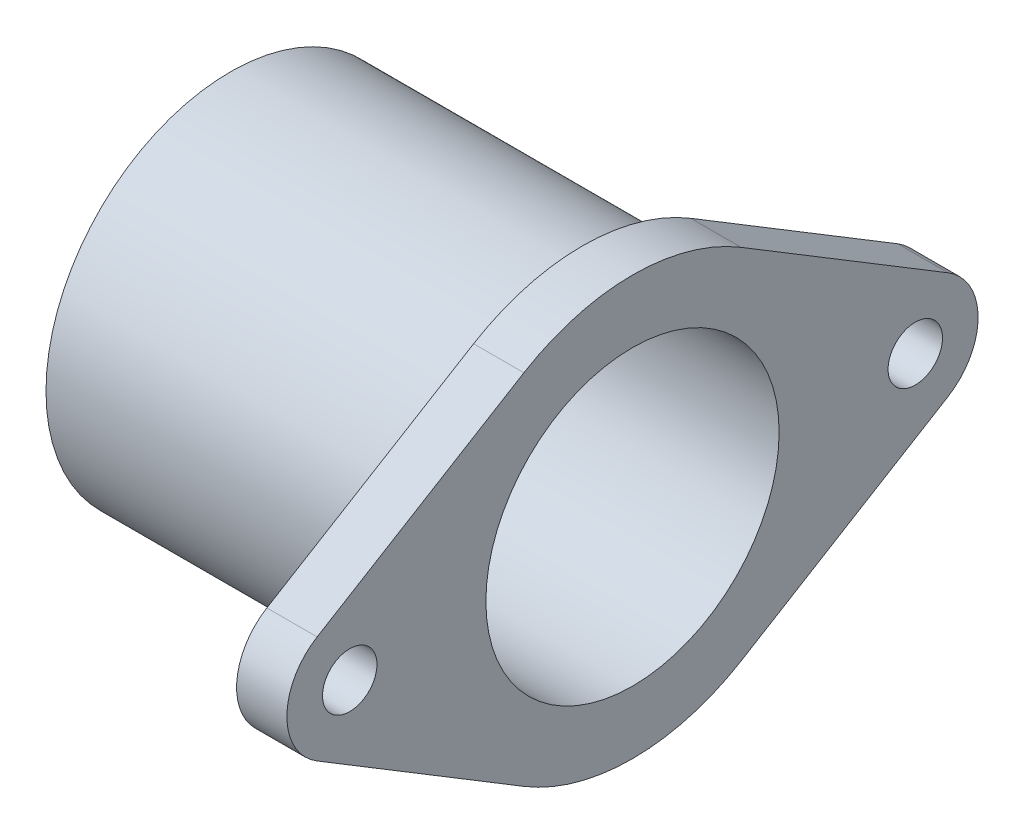
from build123d import *

# Parameters (mm, degrees)
SKETCH1_R           = 44
BOSS_EXTRUDE1_DEPTH = 84
BOSS_EXTRUDE2_DEPTH = 12
SKETCH5_R           = 6.5
CUT_EXTRUDE3_DEPTH  = 80
SKETCH6_R           = 35
CUT_EXTRUDE4_DEPTH  = 85
SKETCH7_R           = 25.25
CUT_EXTRUDE5_DEPTH  = 85


with BuildPart() as part:
    # Sketch1 → Boss-Extrude1 (new body)
    with BuildSketch(Plane(origin=(0, 0, 0), x_dir=(0, 0, -1), z_dir=(1, 0, 0))):
        with Locations(Location((0, 0, 0), (0, 0, 180))):
            Circle(SKETCH1_R)
    extrude(amount=BOSS_EXTRUDE1_DEPTH)

    # Sketch2 → Boss-Extrude2 (add)
    with BuildSketch(Plane(origin=(84, 0, 0), x_dir=(0, 0, -1), z_dir=(1, 0, 0))):
        with BuildLine():
            Line((-25.925925926, 42.753319928), (-75.277777778, 12.825995978))
            ThreePointArc((-75.277777778, 12.825995978), (-82.5, 0), (-75.277777778, -12.825995978))
            Line((-75.277777778, -12.825995978), (-25.925925926, -42.753319928))
            ThreePointArc((-25.925925926, -42.753319928), (0, -50), (25.925925926, -42.753319928))
            Line((25.925925926, -42.753319928), (75.277777778, -12.825995978))
            ThreePointArc((75.277777778, -12.825995978), (82.5, 0), (75.277777778, 12.825995978))
            Line((75.277777778, 12.825995978), (25.925925926, 42.753319928))
            ThreePointArc((25.925925926, 42.753319928), (0, 50), (-25.925925926, 42.753319928))
        make_face()
    extrude(amount=BOSS_EXTRUDE2_DEPTH)

    # Sketch5 → Cut-Extrude3 (cut)
    with BuildSketch(Plane(origin=(96, 0, 0), x_dir=(0, 0, -1), z_dir=(1, 0, 0))):
        with Locations((67.5, 0)):
            Circle(SKETCH5_R)
        with Locations((-67.5, 0)):
            Circle(SKETCH5_R)
    extrude(amount=-CUT_EXTRUDE3_DEPTH, mode=Mode.SUBTRACT)

    # Sketch6 → Cut-Extrude4 (cut)
    with BuildSketch(Plane(origin=(96, 0, 0), x_dir=(0, 0, -1), z_dir=(1, 0, 0))):
        Circle(SKETCH6_R)
    extrude(amount=-CUT_EXTRUDE4_DEPTH, mode=Mode.SUBTRACT)

    # Sketch7 → Cut-Extrude5 (cut)
    with BuildSketch(Plane.ZY):
        Circle(SKETCH7_R)
    extrude(amount=-CUT_EXTRUDE5_DEPTH, mode=Mode.SUBTRACT)


solid = part.part
